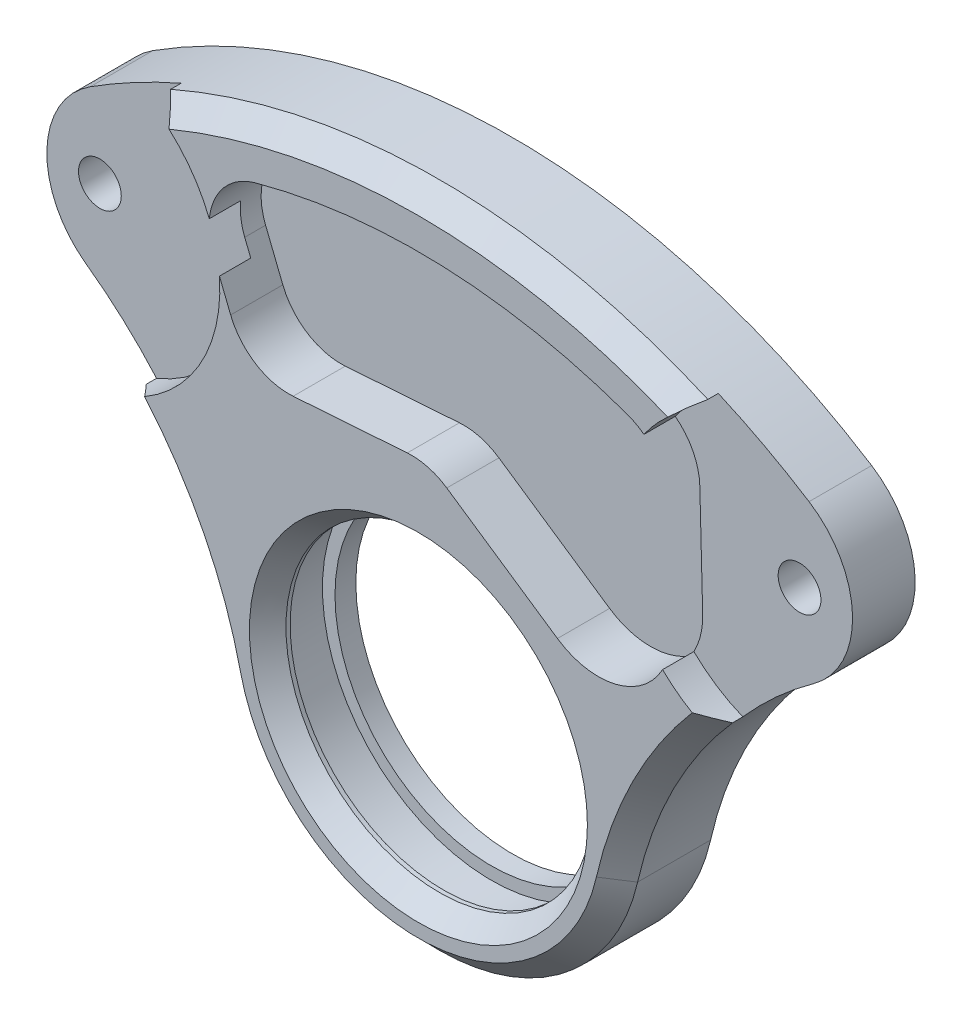
from build123d import *

# Parameters (mm, degrees)
SKETCH1_R           = 19.5
SKETCH1_R_2         = 9
BOSS_EXTRUDE1_DEPTH = 7
SKETCH2_R           = 16.2
CUT_EXTRUDE1_DEPTH  = 60.338592917
SKETCH4_R           = 2
CUT_EXTRUDE2_DEPTH  = 60.338592917
CUT_EXTRUDE3_DEPTH  = 5
CHAMFER1_SIZE       = 2
BOSS_EXTRUDE3_START = 2
SKETCH10_R          = 15
BOSS_EXTRUDE3_DEPTH = 2
SKETCH6_R           = 2.05
CUT_EXTRUDE4_DEPTH  = 60.607622075
BOSS_EXTRUDE2_START = -2.4
SKETCH9_R           = 16.2
SKETCH9_R_2         = 14.7
BOSS_EXTRUDE2_DEPTH = 2.4
CHAMFER2_SIZE       = 1.5
CHAMFER2_SIZE2      = 2
SKETCH12_R          = 14.5
CUT_EXTRUDE5_DEPTH  = 3


with BuildPart() as part:
    # Sketch1 → Boss-Extrude1 (new body)
    with BuildSketch(Plane.XY):
        with BuildLine():
            ThreePointArc((-19.012293257, -4.333901835), (-2.180628521, 19.37768973), (19.5, 0))
            ThreePointArc((19.5, 0), (19.37768973, -2.180628521), (19.012293257, -4.333901835))
            ThreePointArc((19.012293257, -4.333901835), (24.757893691, 9.070013942), (34.874611813, 19.573770268))
            ThreePointArc((34.874611813, 19.573770268), (20.624571786, 26.625396455), (34.450856826, 34.475422864))
            ThreePointArc((34.450856826, 34.475422864), (0, 44.50271884), (-34.450856826, 34.475422864))
            ThreePointArc((-34.450856826, 34.475422864), (-25.289035704, 34.770118001), (-20.620935065, 26.88122404))
            ThreePointArc((-20.620935065, 26.88122404), (-25.515030215, 18.87238234), (-34.874611813, 19.573770268))
            ThreePointArc((-34.874611813, 19.573770268), (-24.757893691, 9.070013942), (-19.012293257, -4.333901835))
        make_face()
        Circle(SKETCH1_R)
        with Locations((29.620935065, 26.88122404)):
            Circle(SKETCH1_R_2)
        with Locations((-29.620935065, 26.88122404)):
            Circle(SKETCH1_R_2)
    extrude(amount=BOSS_EXTRUDE1_DEPTH)

    # Sketch2 → Cut-Extrude1 (cut, through all)
    with BuildSketch(Plane.XY.offset(7)):
        Circle(SKETCH2_R)
    extrude(amount=-CUT_EXTRUDE1_DEPTH, mode=Mode.SUBTRACT)

    # Sketch4 → Cut-Extrude2 (cut, through all)
    with BuildSketch(Plane.XY.offset(7)):
        with Locations((-33.536442335, 26.88122404)):
            Circle(SKETCH4_R)
        with Locations((33.536442335, 26.88122404)):
            Circle(SKETCH4_R)
    extrude(amount=-CUT_EXTRUDE2_DEPTH, mode=Mode.SUBTRACT)

    # Sketch5 → Cut-Extrude3 (cut)
    with BuildSketch(Plane.XY.offset(7)):
        with BuildLine():
            Line((-1.067353397, 22.26157723), (-12.010449995, 21.49536658))
            ThreePointArc((-12.010449995, 21.49536658), (-15.616534718, 22.397111634), (-17.999430218, 25.249969887))
            Line((-17.999430218, 25.249969887), (-19.651256781, 29.374384133))
            ThreePointArc((-19.651256781, 29.374384133), (-19.455065625, 34.274069739), (-15.669623618, 37.391093771))
            ThreePointArc((-15.669623618, 37.391093771), (2.275327553, 39.45897348), (20.008401242, 36.018697829))
            ThreePointArc((20.008401242, 36.018697829), (22.842395778, 33.887599296), (23.978309208, 30.528610361))
            Line((23.978309208, 30.528610361), (24.25275428, 20.02870061))
            ThreePointArc((24.25275428, 20.02870061), (20.614925778, 13.704799196), (13.327584238, 14.051467043))
            Line((13.327584238, 14.051467043), (2.718206877, 21.242800312))
            ThreePointArc((2.718206877, 21.242800312), (0.910979227, 22.07008378), (-1.067353397, 22.26157723))
        make_face()
    extrude(amount=-CUT_EXTRUDE3_DEPTH, mode=Mode.SUBTRACT)

    # Chamfer1
    chamfer1_edges = [part.edges().sort_by_distance(p)[0] for p in [
        (0, -19.5, 7),
        (24.757893691, 9.070013942, 7),
        (38.617298344, 27.137051625, 7),
        (0, 44.50271884, 7),
        (-38.617298344, 27.137051625, 7),
        (-24.757893691, 9.070013942, 7),
    ]]
    chamfer(chamfer1_edges, length=CHAMFER1_SIZE)

    # Sketch10 → Boss-Extrude3 (add)
    with BuildSketch(Plane(origin=(0, 0, 0), x_dir=(-1, 0, 0), z_dir=(0, 0, -1)).offset(BOSS_EXTRUDE3_START)):
        with BuildLine():
            ThreePointArc((34.874611813, 19.573770268), (24.757893691, 9.070013942), (19.012293257, -4.333901835))
            ThreePointArc((19.012293257, -4.333901835), (0, -19.5), (-19.012293257, -4.333901835))
            ThreePointArc((-19.012293257, -4.333901835), (-24.757893691, 9.070013942), (-34.874611813, 19.573770268))
            ThreePointArc((-34.874611813, 19.573770268), (-38.617298344, 27.137051625), (-34.450856826, 34.475422864))
            ThreePointArc((-34.450856826, 34.475422864), (0, 44.50271884), (34.450856826, 34.475422864))
            ThreePointArc((34.450856826, 34.475422864), (38.617298344, 27.137051625), (34.874611813, 19.573770268))
        make_face()
        Circle(SKETCH10_R, mode=Mode.SUBTRACT)
    extrude(amount=-BOSS_EXTRUDE3_DEPTH)

    # Sketch6 → Cut-Extrude4 (cut, through all)
    with BuildSketch(Plane(origin=(0, 0, -2), x_dir=(-1, 0, 0), z_dir=(0, 0, -1))):
        with Locations((-33.536442335, 26.88122404)):
            Circle(SKETCH6_R)
        with Locations((33.536442335, 26.88122404)):
            Circle(SKETCH6_R)
    extrude(amount=-CUT_EXTRUDE4_DEPTH, mode=Mode.SUBTRACT)

    # Sketch9 → Boss-Extrude2 (add)
    with BuildSketch(Plane.XY.offset(7).offset(BOSS_EXTRUDE2_START)):
        Circle(SKETCH9_R)
        Circle(SKETCH9_R_2, mode=Mode.SUBTRACT)
    extrude(amount=BOSS_EXTRUDE2_DEPTH)

    # Chamfer2
    chamfer2_edges = [part.edges().sort_by_distance(p)[0] for p in [
        (-14.7, 0, 7),
    ]]
    chamfer2_side = [part.faces().sort_by_distance(p)[0] for p in [
        (-2.793334658, 18.408509584, 7),
    ]]
    chamfer(chamfer2_edges, length=CHAMFER2_SIZE, length2=CHAMFER2_SIZE2, reference=chamfer2_side[0])

    # Sketch12 → Cut-Extrude5 (cut)
    with BuildSketch(Plane.XY.offset(7)):
        with Locations((-33.536442335, 26.88122404)):
            Circle(SKETCH12_R)
        with Locations((33.536442335, 26.88122404)):
            Circle(SKETCH12_R)
    extrude(amount=-CUT_EXTRUDE5_DEPTH, mode=Mode.SUBTRACT)


solid = part.part
